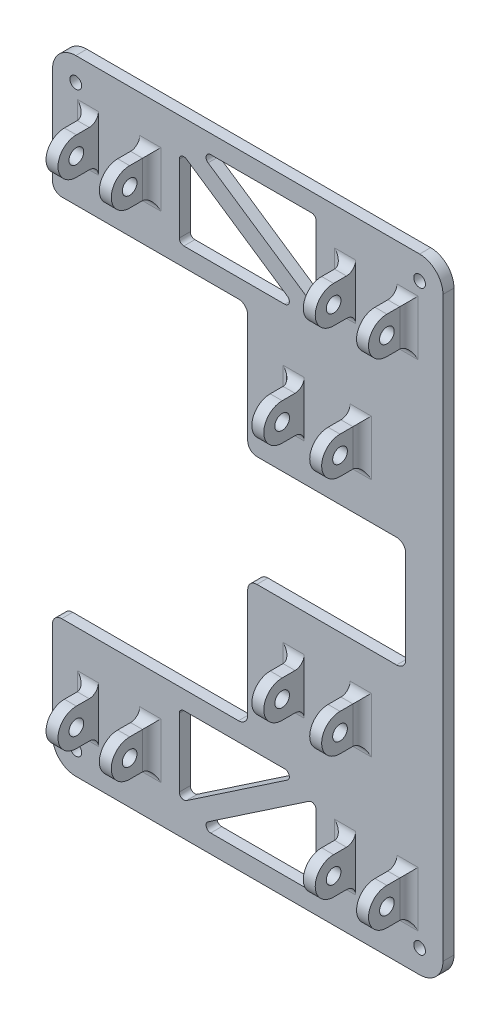
from build123d import *

# Parameters (mm, degrees)
SKETCH1_W               = 212.5
SKETCH1_H               = 339.725
BOSS_EXTRUDE1_DEPTH     = 6
SKETCH2_W               = 6.5
SKETCH2_H               = 20
BOSS_EXTRUDE2_DEPTH     = 24
CUT_EXTRUDE1_DEPTH      = 393.36344838
CUT_EXTRUDE1_DEPTH_BACK = 393.36344838
SKETCH3_R               = 4
FILLET2_R               = 5
SKETCH5_R               = 3.175
CUT_EXTRUDE2_DEPTH      = 402.314497153


with BuildPart() as part:
    # Sketch1 → Boss-Extrude1 (new body)
    with BuildSketch(Plane.XY):
        with Locations((106.25, -169.8625)):
            Rectangle(SKETCH1_W, SKETCH1_H)
    extrude(amount=BOSS_EXTRUDE1_DEPTH)

    # Sketch2 → Boss-Extrude2 (add)
    with BuildSketch(Plane.XY.offset(6)):
        with Locations((21.75, -35.2425)):
            Rectangle(SKETCH2_W, SKETCH2_H)
        with Locations((50.75, -35.2425)):
            Rectangle(SKETCH2_W, SKETCH2_H)
        with Locations((161.75, -35.2425)):
            Rectangle(SKETCH2_W, SKETCH2_H)
        with Locations((190.75, -35.2425)):
            Rectangle(SKETCH2_W, SKETCH2_H)
        with Locations((133.75, -104.5325)):
            Rectangle(SKETCH2_W, SKETCH2_H)
        with Locations((165.25, -104.5325)):
            Rectangle(SKETCH2_W, SKETCH2_H)
        with Locations((165.25, -235.1925)):
            Rectangle(SKETCH2_W, SKETCH2_H)
        with Locations((21.75, -304.4825)):
            Rectangle(SKETCH2_W, SKETCH2_H)
        with Locations((50.75, -304.4825)):
            Rectangle(SKETCH2_W, SKETCH2_H)
        with Locations((190.75, -304.4825)):
            Rectangle(SKETCH2_W, SKETCH2_H)
        with Locations((161.75, -304.4825)):
            Rectangle(SKETCH2_W, SKETCH2_H)
        with Locations((133.75, -235.1925)):
            Rectangle(SKETCH2_W, SKETCH2_H)
    extrude(amount=BOSS_EXTRUDE2_DEPTH)

    # Sketch3 → Cut-Extrude1 (cut, two sides: drawn at the far end of the back side and taken through both)
    with BuildSketch(Plane.ZY.offset(-18.5).offset(-CUT_EXTRUDE1_DEPTH_BACK)):
        with Locations((18, -35.2425)):
            Circle(SKETCH3_R)
        with Locations((18, -235.1925)):
            Circle(SKETCH3_R)
        with Locations((18, -304.4825)):
            Circle(SKETCH3_R)
        with Locations((18, -104.5325)):
            Circle(SKETCH3_R)
        with BuildLine():
            Line((18, -25.2425), (18, -12.982943413))
            Line((18, -12.982943413), (51.949532367, -12.982943413))
            Line((51.949532367, -12.982943413), (51.949532367, -57.481006387))
            Line((51.949532367, -57.481006387), (18, -57.481006387))
            Line((18, -57.481006387), (18, -45.2425))
            ThreePointArc((18, -45.2425), (28, -35.2425), (18, -25.2425))
        make_face()
        with BuildLine():
            Line((52.442304634, -132.399123951), (18, -132.399123951))
            Line((18, -132.399123951), (18, -114.5325))
            ThreePointArc((18, -114.5325), (28, -104.5325), (18, -94.5325))
            Line((18, -94.5325), (18, -71.59149594))
            Line((18, -71.59149594), (52.442304634, -71.59149594))
            Line((52.442304634, -71.59149594), (52.442304634, -132.399123951))
        make_face()
        with BuildLine():
            Line((52.599532243, -270.375386727), (18, -270.375386727))
            Line((18, -270.375386727), (18, -245.1925))
            ThreePointArc((18, -245.1925), (28, -235.1925), (18, -225.1925))
            Line((18, -225.1925), (18, -207.306351849))
            Line((18, -207.306351849), (52.599532243, -207.306351849))
            Line((52.599532243, -207.306351849), (52.599532243, -270.375386727))
        make_face()
        with BuildLine():
            Line((52.621034016, -326.721115515), (18, -326.721115515))
            Line((18, -326.721115515), (18, -314.4825))
            ThreePointArc((18, -314.4825), (28, -304.4825), (18, -294.4825))
            Line((18, -294.4825), (18, -282.222834285))
            Line((18, -282.222834285), (52.621034016, -282.222834285))
            Line((52.621034016, -282.222834285), (52.621034016, -326.721115515))
        make_face()
    extrude(amount=CUT_EXTRUDE1_DEPTH + CUT_EXTRUDE1_DEPTH_BACK, mode=Mode.SUBTRACT)

    # Fillet2
    fillet2_edges = [part.edges().sort_by_distance(p)[0] for p in [
        (158.5, -304.4825, 6),
        (18.5, -304.4825, 6),
        (21.75, -45.2425, 6),
        (18.5, -35.2425, 6),
        (21.75, -25.2425, 6),
        (50.75, -25.2425, 6),
        (50.75, -45.2425, 6),
        (54, -35.2425, 6),
        (161.75, -25.2425, 6),
        (190.75, -25.2425, 6),
        (194, -35.2425, 6),
        (190.75, -45.2425, 6),
        (161.75, -45.2425, 6),
        (158.5, -35.2425, 6),
        (168.5, -104.5325, 6),
        (165.25, -114.5325, 6),
        (133.75, -114.5325, 6),
        (130.5, -104.5325, 6),
        (165.25, -94.5325, 6),
        (133.75, -94.5325, 6),
        (21.75, -294.4825, 6),
        (50.75, -294.4825, 6),
        (54, -304.4825, 6),
        (194, -304.4825, 6),
        (161.75, -294.4825, 6),
        (190.75, -294.4825, 6),
        (190.75, -314.4825, 6),
        (161.75, -314.4825, 6),
        (50.75, -314.4825, 6),
        (21.75, -314.4825, 6),
        (165.25, -225.1925, 6),
        (133.75, -225.1925, 6),
        (130.5, -235.1925, 6),
        (133.75, -245.1925, 6),
        (165.25, -245.1925, 6),
        (168.5, -235.1925, 6),
    ]]
    fillet(fillet2_edges, radius=FILLET2_R)

    # Sketch5 → Cut-Extrude2 (cut, through all)
    with BuildSketch(Plane.XY.offset(6)):
        with BuildLine():
            Line((141, -10), (86.089952747, -10))
            ThreePointArc((86.089952747, -10), (83.699567237, -11.767840789), (84.689838532, -14.571154312))
            Line((84.689838532, -14.571154312), (139.599885785, -51.690714779))
            ThreePointArc((139.599885785, -51.690714779), (142.172543061, -51.827533014), (143.5, -49.619560467))
            Line((143.5, -49.619560467), (143.5, -12.5))
            ThreePointArc((143.5, -12.5), (142.767766953, -10.732233047), (141, -10))
        make_face()
        with BuildLine():
            ThreePointArc((0, -12.7), (3.719743879, -3.719743879), (12.7, 0))
            Line((12.7, 0), (0, 0))
            Line((0, 0), (0, -12.7))
        make_face()
        with BuildLine():
            Line((212.5, 0), (199.8, 0))
            ThreePointArc((199.8, 0), (208.780256121, -3.719743879), (212.5, -12.7))
            Line((212.5, -12.7), (212.5, 0))
        make_face()
        with BuildLine():
            ThreePointArc((5, -70.4825), (1.464466094, -69.018033906), (0, -65.4825))
            Line((0, -65.4825), (0, -274.2425))
            ThreePointArc((0, -274.2425), (1.464466094, -270.706966094), (5, -269.2425))
            Line((5, -269.2425), (101.25, -269.2425))
            ThreePointArc((101.25, -269.2425), (104.785533906, -267.778033906), (106.25, -264.2425))
            Line((106.25, -264.2425), (106.25, -204.9525))
            ThreePointArc((106.25, -204.9525), (107.714466094, -201.416966094), (111.25, -199.9525))
            Line((111.25, -199.9525), (187.26, -199.9525))
            ThreePointArc((187.26, -199.9525), (190.795533906, -198.488033906), (192.26, -194.9525))
            Line((192.26, -194.9525), (192.26, -144.7725))
            ThreePointArc((192.26, -144.7725), (190.795533906, -141.236966094), (187.26, -139.7725))
            Line((187.26, -139.7725), (111.25, -139.7725))
            ThreePointArc((111.25, -139.7725), (107.714466094, -138.308033906), (106.25, -134.7725))
            Line((106.25, -134.7725), (106.25, -75.4825))
            ThreePointArc((106.25, -75.4825), (104.785533906, -71.946966094), (101.25, -70.4825))
            Line((101.25, -70.4825), (5, -70.4825))
        make_face()
        with BuildLine():
            Line((212.5, -339.725), (212.5, -327.025))
            ThreePointArc((212.5, -327.025), (208.780256121, -336.005256121), (199.8, -339.725))
            Line((199.8, -339.725), (212.5, -339.725))
        make_face()
        with BuildLine():
            Line((0, -339.725), (12.7, -339.725))
            ThreePointArc((12.7, -339.725), (3.719743879, -336.005256121), (0, -327.025))
            Line((0, -327.025), (0, -339.725))
        make_face()
        with BuildLine():
            ThreePointArc((72.900114215, -18.671785221), (70.327456939, -18.534966986), (69, -20.742939533))
            Line((69, -20.742939533), (69, -57.8625))
            ThreePointArc((69, -57.8625), (69.732233047, -59.630266953), (71.5, -60.3625))
            Line((71.5, -60.3625), (126.410047253, -60.3625))
            ThreePointArc((126.410047253, -60.3625), (128.800432763, -58.594659211), (127.810161468, -55.791345688))
            Line((127.810161468, -55.791345688), (72.900114215, -18.671785221))
        make_face()
        with BuildLine():
            Line((126.410047253, -279.3625), (71.5, -279.3625))
            ThreePointArc((71.5, -279.3625), (69.732233047, -280.094733047), (69, -281.8625))
            Line((69, -281.8625), (69, -318.982060467))
            ThreePointArc((69, -318.982060467), (70.327456939, -321.190033014), (72.900114215, -321.053214779))
            Line((72.900114215, -321.053214779), (127.810161468, -283.933654312))
            ThreePointArc((127.810161468, -283.933654312), (128.800432763, -281.130340789), (126.410047253, -279.3625))
        make_face()
        with BuildLine():
            Line((139.599885785, -288.034285221), (84.689838532, -325.153845688))
            ThreePointArc((84.689838532, -325.153845688), (83.699567237, -327.957159211), (86.089952747, -329.725))
            Line((86.089952747, -329.725), (141, -329.725))
            ThreePointArc((141, -329.725), (142.767766953, -328.992766953), (143.5, -327.225))
            Line((143.5, -327.225), (143.5, -290.105439533))
            ThreePointArc((143.5, -290.105439533), (142.172543061, -287.897466986), (139.599885785, -288.034285221))
        make_face()
        with Locations((12.7, -12.7)):
            Circle(SKETCH5_R)
        with Locations((199.8, -12.7)):
            Circle(SKETCH5_R)
        with Locations((12.7, -327.025)):
            Circle(SKETCH5_R)
        with Locations((199.8, -327.025)):
            Circle(SKETCH5_R)
    extrude(amount=-CUT_EXTRUDE2_DEPTH, mode=Mode.SUBTRACT)


solid = part.part
